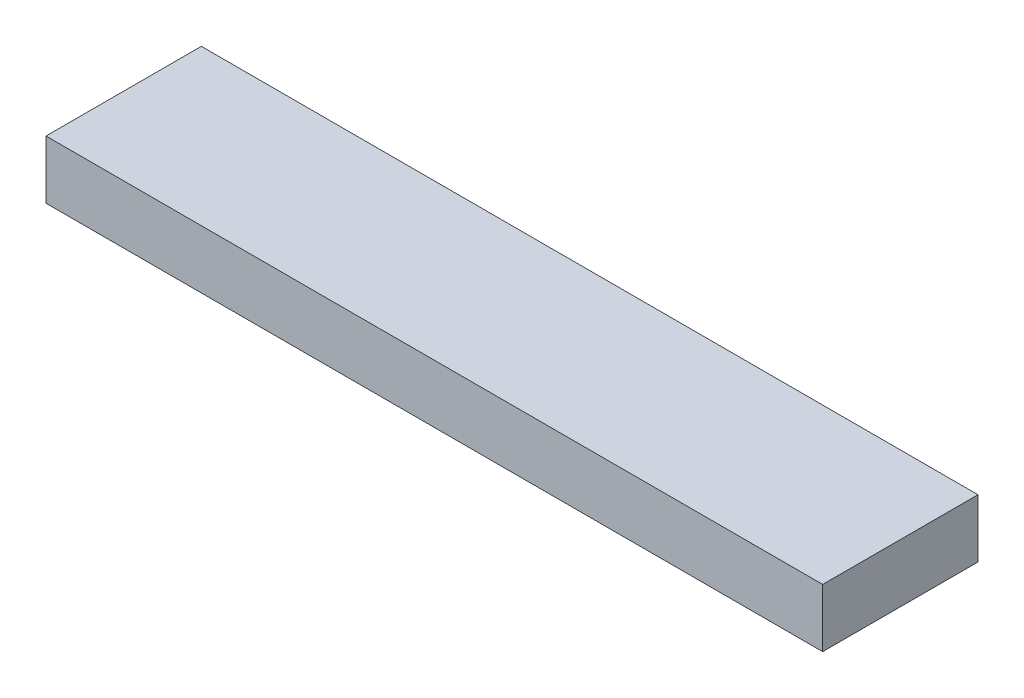
from build123d import *

# Parameters (mm, degrees)
SKETCH1_W           = 40
SKETCH1_H           = 8
BOSS_EXTRUDE1_DEPTH = 3


with BuildPart() as part:
    # Sketch1 → Boss-Extrude1 (new body)
    with BuildSketch(Plane(origin=(0, 0, 0), x_dir=(1, 0, 0), z_dir=(0, 1, 0))):
        Rectangle(SKETCH1_W, SKETCH1_H)
    extrude(amount=BOSS_EXTRUDE1_DEPTH)


solid = part.part
